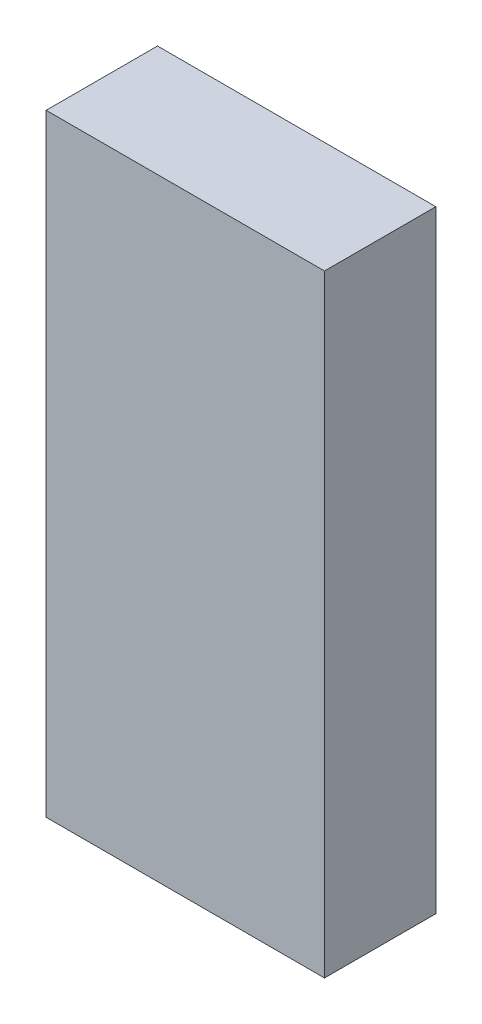
from build123d import *

# Parameters (mm, degrees)
ESQUISSE1_W        = 35
ESQUISSE1_H        = 77
BOSS_EXTRU_1_DEPTH = 14


with BuildPart() as part:
    # Esquisse1 → Boss.-Extru.1 (new body)
    with BuildSketch(Plane.XY):
        with Locations((-17.5, 38.5)):
            Rectangle(ESQUISSE1_W, ESQUISSE1_H)
    extrude(amount=BOSS_EXTRU_1_DEPTH)


solid = part.part
